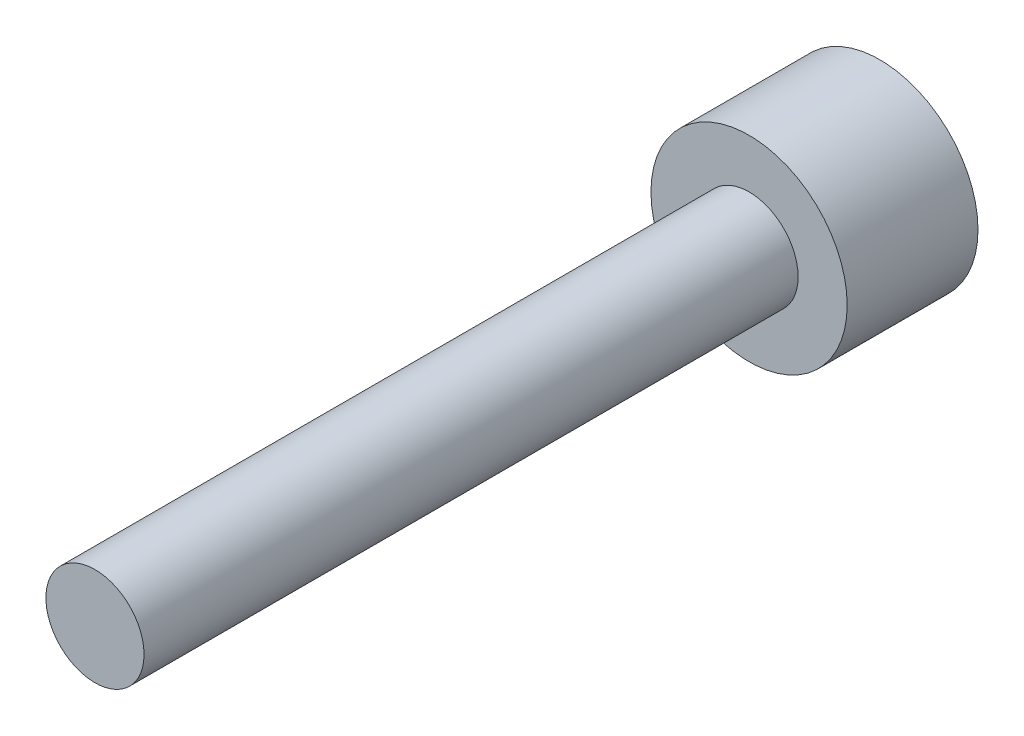
from build123d import *

# Parameters (mm, degrees)
SKETCH_1_R      = 3
EXTRUDE_1_DEPTH = 4
SKETCH_2_R      = 1.5
EXTRUDE_2_DEPTH = 20


with BuildPart() as part:
    # 草图1 → 拉伸1 (new body)
    with BuildSketch(Plane.XY):
        Circle(SKETCH_1_R)
    extrude(amount=EXTRUDE_1_DEPTH)

    # 草图2 → 拉伸2 (add)
    with BuildSketch(Plane.XY.offset(4)):
        Circle(SKETCH_2_R)
    extrude(amount=EXTRUDE_2_DEPTH)


solid = part.part
